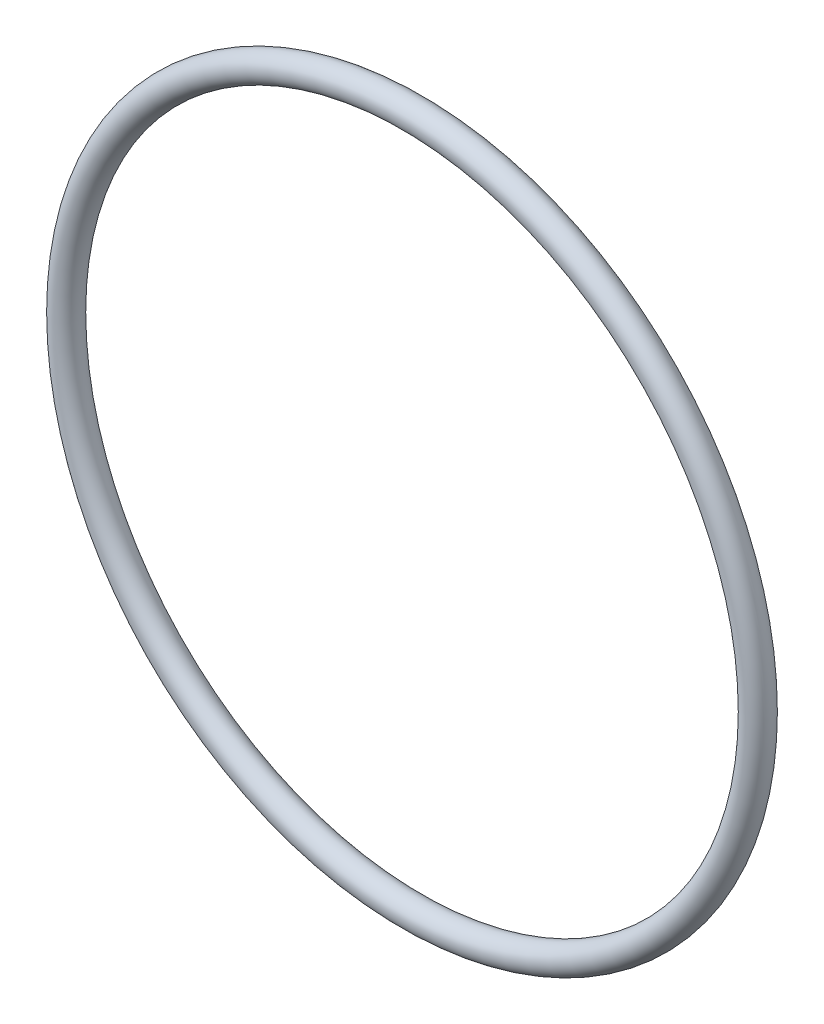
from build123d import *

# Parameters (mm, degrees)
SWEEP1_PROFILE_R = 1.524


with BuildPart() as part:
    # Sweep1: sweep along a path in Sketch1
    with BuildLine(Plane.XY) as sweep1_path:
        CenterArc((0, 0), 38.1, 0, 360)
    # Sweep1 profile (on start of the path) → Sweep1 (sweep)
    with BuildSketch(Plane(origin=(38.1, 0, 0), x_dir=(0, 0, 1), z_dir=(0, 1, 0))):
        Circle(SWEEP1_PROFILE_R)
    sweep(path=sweep1_path.line)


solid = part.part
